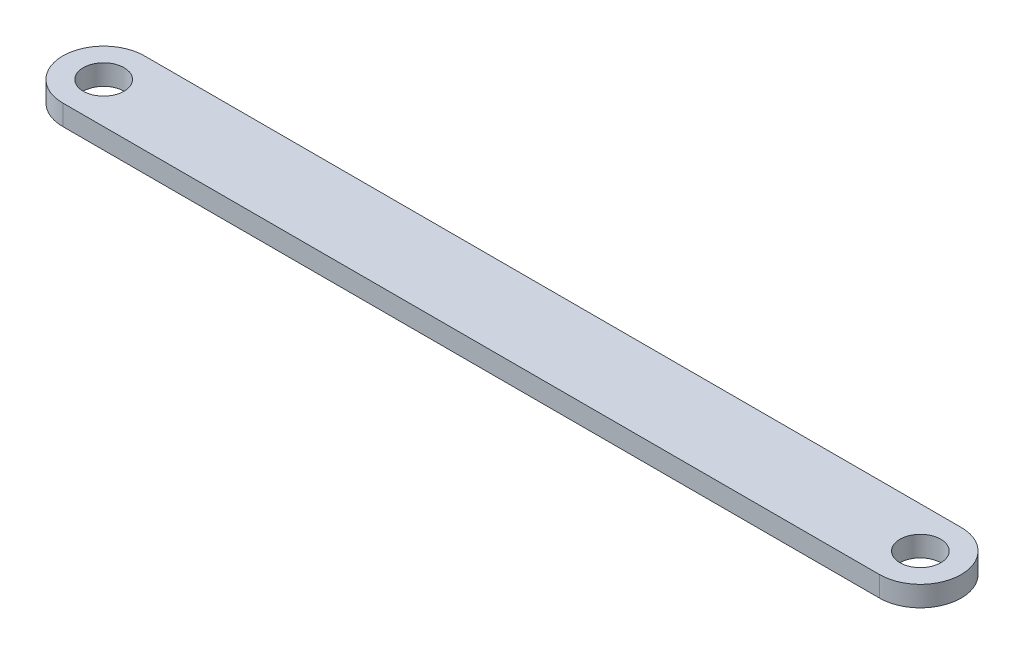
from build123d import *

# Parameters (mm, degrees)
SKETCH1_R           = 5
BOSS_EXTRUDE1_DEPTH = 5


with BuildPart() as part:
    # Sketch1 → Boss-Extrude1 (new body)
    with BuildSketch(Plane(origin=(0, 0, 0), x_dir=(1, 0, 0), z_dir=(0, 1, 0))):
        with BuildLine():
            Line((-100, 10), (100, 10))
            ThreePointArc((100, 10), (110, 0), (100, -10))
            Line((100, -10), (-100, -10))
            ThreePointArc((-100, -10), (-110, 0), (-100, 10))
        make_face()
        with Locations(Location((-100, 0, 0), (0, 0, 270))):
            Circle(SKETCH1_R, mode=Mode.SUBTRACT)
        with Locations(Location((100, 0, 0), (0, 0, 270))):
            Circle(SKETCH1_R, mode=Mode.SUBTRACT)
    extrude(amount=BOSS_EXTRUDE1_DEPTH)


solid = part.part
